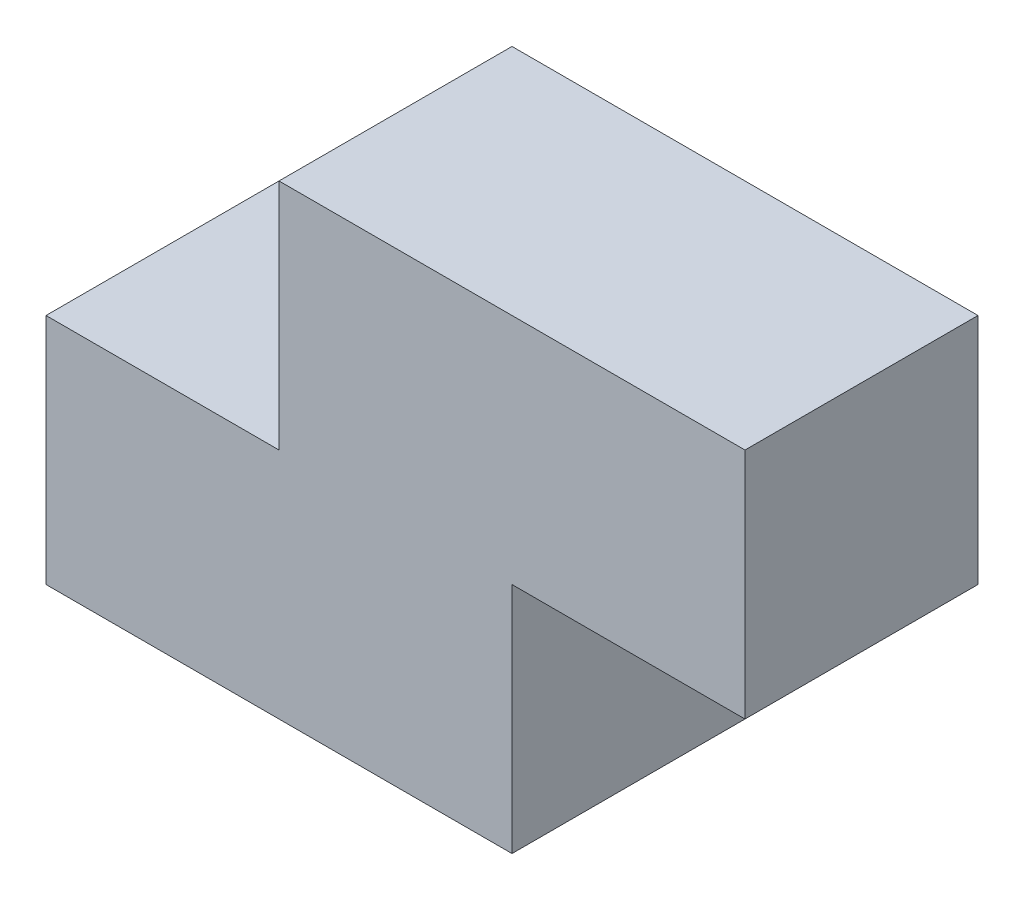
from build123d import *

# Parameters (mm, degrees)
SKETCH_1_W      = 60
SKETCH_1_H      = 30
EXTRUDE_1_DEPTH = 30
SKETCH_2_W      = 30
SKETCH_2_H      = 30
EXTRUDE_2_DEPTH = 30
SKETCH_3_W      = 30
SKETCH_3_H      = 30
EXTRUDE_3_DEPTH = 30


with BuildPart() as part:
    # 草圖1 → 填料-伸長1 (new body)
    with BuildSketch(Plane(origin=(0, 0, 0), x_dir=(1, 0, 0), z_dir=(0, 1, 0))):
        with Locations((30, -15)):
            Rectangle(SKETCH_1_W, SKETCH_1_H)
    extrude(amount=EXTRUDE_1_DEPTH)

    # 草圖2 → 填料-伸長2 (add)
    with BuildSketch(Plane(origin=(0, 30, 0), x_dir=(1, 0, 0), z_dir=(0, 1, 0))):
        with Locations((45, -15)):
            Rectangle(SKETCH_2_W, SKETCH_2_H)
    extrude(amount=EXTRUDE_2_DEPTH)

    # 草圖3 → 填料-伸長3 (add)
    with BuildSketch(Plane(origin=(60, 0, 0), x_dir=(0, 0, -1), z_dir=(1, 0, 0))):
        with Locations((-15, 45)):
            Rectangle(SKETCH_3_W, SKETCH_3_H)
    extrude(amount=EXTRUDE_3_DEPTH)


solid = part.part
